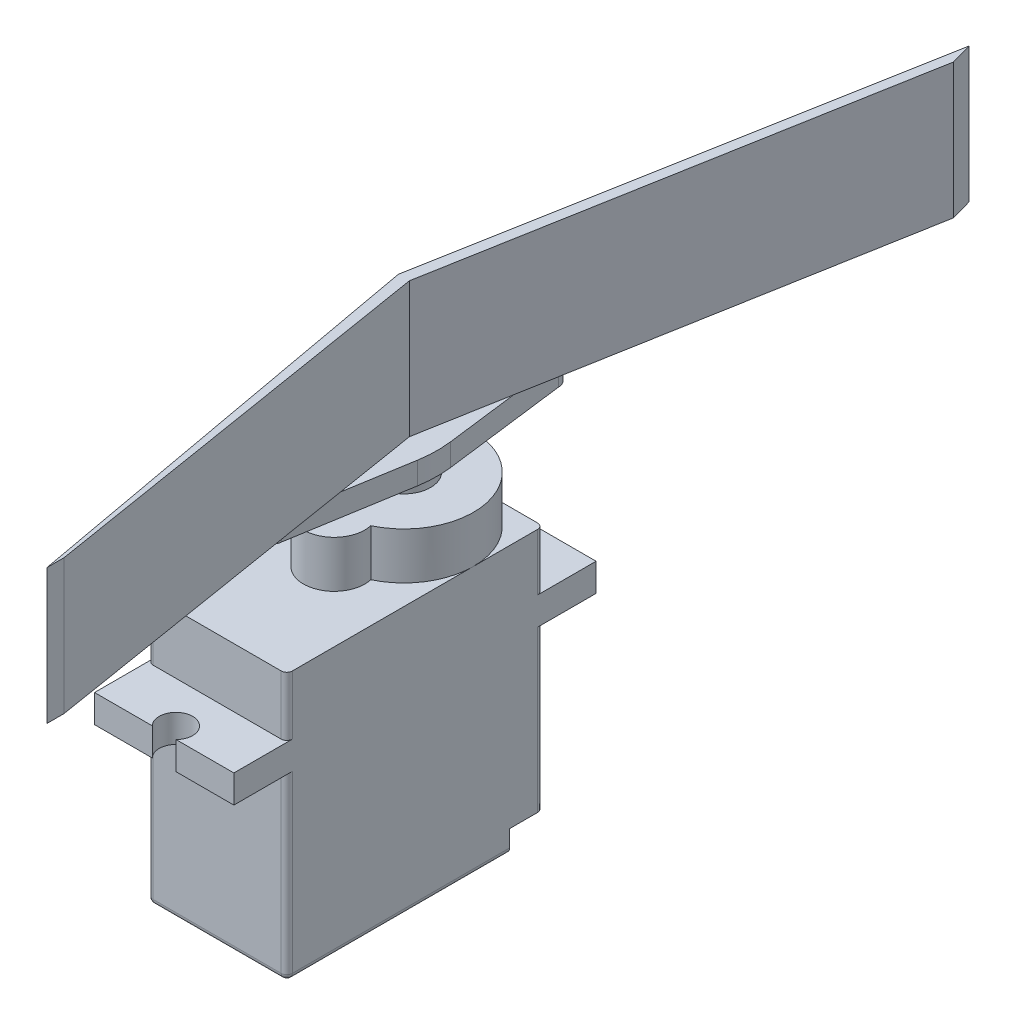
from build123d import *

# Parameters (mm, degrees)
SKETCH1_W               = 12.5
SKETCH1_H               = 23
BOSS_EXTRUDE1_DEPTH     = 24
BOSS_EXTRUDE2_DEPTH     = 4.2
SKETCH3_R               = 2.4
SKETCH3_R_2             = 0.5
BOSS_EXTRUDE3_DEPTH     = 3
SKETCH4_W               = 12.5
SKETCH4_H               = 2.5
BOSS_EXTRUDE4_DEPTH     = 4.75
SKETCH5_W               = 12.5
SKETCH5_H               = 2.5
BOSS_EXTRUDE5_DEPTH     = 4.75
CUT_EXTRUDE1_REACH      = 27.55
SKETCH6_R               = 1.5
CUT_EXTRUDE2_REACH      = 27.697
SKETCH8_R               = 1.5
CUT_EXTRUDE4_DEPTH      = 38.33299479
CUT_EXTRUDE6_DEPTH      = 38.33299479
CUT_EXTRUDE6_DEPTH_BACK = 2.3
CUT_EXTRUDE7_DEPTH      = 38.33299479
CUT_EXTRUDE7_DEPTH_BACK = 2.3
FILLET1_R               = 0.5
SALIENTE_EXTRUIR2_START = -2
CROQUIS2_R              = 2.4
SALIENTE_EXTRUIR2_DEPTH = 2
REDONDEO1_R             = 10
SALIENTE_EXTRUIR5_DEPTH = 12.116642018


with BuildPart() as part:
    # Sketch1 → Boss-Extrude1 (new body)
    with BuildSketch(Plane(origin=(0, 0, 0), x_dir=(1, 0, 0), z_dir=(0, 1, 0))):
        Rectangle(SKETCH1_W, SKETCH1_H)
    extrude(amount=BOSS_EXTRUDE1_DEPTH)

    # Sketch2 → Boss-Extrude2 (add)
    with BuildSketch(Plane(origin=(0, 24, 0), x_dir=(1, 0, 0), z_dir=(0, 1, 0))):
        with BuildLine():
            ThreePointArc((2.682624648, -0.395), (0, 11.5), (-2.682624648, -0.395))
            ThreePointArc((-2.682624648, -0.395), (0, -3.75), (2.682624648, -0.395))
        make_face()
    extrude(amount=BOSS_EXTRUDE2_DEPTH)

    # Sketch3 → Boss-Extrude3 (add)
    with BuildSketch(Plane(origin=(0, 28.2, 0), x_dir=(1, 0, 0), z_dir=(0, 1, 0))):
        with Locations(Location((0, 5.25, 0), (0, 0, 270))):
            Circle(SKETCH3_R)
        with Locations(Location((0, 5.25, 0), (0, 0, 270))):
            Circle(SKETCH3_R_2, mode=Mode.SUBTRACT)
    extrude(amount=BOSS_EXTRUDE3_DEPTH)

    # Sketch4 → Boss-Extrude4 (add)
    with BuildSketch(Plane(origin=(0, 0, -11.5), x_dir=(-1, 0, 0), z_dir=(0, 0, -1))):
        with Locations((0, 17.65)):
            Rectangle(SKETCH4_W, SKETCH4_H)
    extrude(amount=BOSS_EXTRUDE4_DEPTH)

    # Sketch5 → Boss-Extrude5 (add)
    with BuildSketch(Plane.XY.offset(11.5)):
        with Locations((0, 17.45)):
            Rectangle(SKETCH5_W, SKETCH5_H)
    extrude(amount=BOSS_EXTRUDE5_DEPTH)

    # Sketch6 → Cut-Extrude1 (cut, up to next)
    with BuildSketch(Plane(origin=(0, 18.7, 0), x_dir=(1, 0, 0), z_dir=(0, 1, 0)), mode=Mode.PRIVATE) as cut_extrude1_sk1:
        with Locations((0, -15.2)):
            Circle(SKETCH6_R)
    cut_extrude1_tool1 = extrude(cut_extrude1_sk1.sketch, amount=-CUT_EXTRUDE1_REACH, mode=Mode.PRIVATE) & part.part
    add(cut_extrude1_tool1.solids().sort_by_distance((0, 18.7, 15.2))[0], mode=Mode.SUBTRACT)

    # Sketch8 → Cut-Extrude2 (cut, up to next)
    with BuildSketch(Plane(origin=(0, 18.9, 0), x_dir=(1, 0, 0), z_dir=(0, 1, 0)), mode=Mode.PRIVATE) as cut_extrude2_sk1:
        with Locations((0, 15.2)):
            Circle(SKETCH8_R)
    cut_extrude2_tool1 = extrude(cut_extrude2_sk1.sketch, amount=-CUT_EXTRUDE2_REACH, mode=Mode.PRIVATE) & part.part
    add(cut_extrude2_tool1.solids().sort_by_distance((0, 18.9, -15.2))[0], mode=Mode.SUBTRACT)

    # Sketch9 → Cut-Extrude4 (cut, through all)
    with BuildSketch(Plane(origin=(6.25, 0, 0), x_dir=(0, 0, -1), z_dir=(1, 0, 0))):
        Polygon((11.5, 2), (8.5, 0), (11.5, 0), align=None)
    extrude(amount=-CUT_EXTRUDE4_DEPTH, mode=Mode.SUBTRACT)

    # Sketch10 → Cut-Extrude6 (cut, two sides: drawn at the far end of the back side and taken through both)
    with BuildSketch(Plane(origin=(6.25, 0, 0), x_dir=(0, 0, -1), z_dir=(1, 0, 0)).offset(-CUT_EXTRUDE6_DEPTH_BACK)):
        Polygon((102.065563363, 2), (11.5, 2), (8.5, 2), (8.5, 0), (8.5, -90.565563363), (135.889097577, -219.33086493), (229.45466094, -126.765301567), align=None)
    extrude(amount=CUT_EXTRUDE6_DEPTH + CUT_EXTRUDE6_DEPTH_BACK, mode=Mode.SUBTRACT)

    # Sketch11 → Cut-Extrude7 (cut, two sides: drawn at the far end of the back side and taken through both)
    with BuildSketch(Plane.ZY.offset(6.25).offset(-CUT_EXTRUDE7_DEPTH_BACK)):
        Polygon((-102.065563363, 2), (-11.5, 2), (-8.5, 2), (-8.5, 0), (-8.5, -90.565563363), (-135.889097577, -219.33086493), (-229.45466094, -126.765301567), align=None)
    extrude(amount=CUT_EXTRUDE7_DEPTH + CUT_EXTRUDE7_DEPTH_BACK, mode=Mode.SUBTRACT)

    # Fillet1
    fillet1_edges = [part.edges().sort_by_distance(p)[0] for p in [
        (-6.25, 9.2, -11.5),
        (6.25, 9.2, -11.5),
        (6.25, 8.1, 11.5),
        (-6.25, 8.1, 11.5),
        (6.25, 0, 1.5),
        (0, 0, 11.5),
        (-6.25, 21.45, -11.5),
        (6.25, 21.45, -11.5),
        (6.25, 21.35, 11.5),
        (-6.25, 0, 1.5),
        (-6.25, 21.35, 11.5),
    ]]
    fillet(fillet1_edges, radius=FILLET1_R)

    # Croquis2 → Saliente-Extruir2 (add)
    with BuildSketch(Plane(origin=(0, 31.2, 0), x_dir=(1, 0, 0), z_dir=(0, 1, 0)).offset(SALIENTE_EXTRUIR2_START)):
        with BuildLine():
            Line((-2.926200175, 5.25), (-0.834835747, -6.772385738))
            ThreePointArc((-0.834835747, -6.772385738), (0.100143784, -7.508414302), (0.947766476, -6.673273269))
            Line((0.947766476, -6.673273269), (2.926200175, 5.25))
            Line((2.926200175, 5.25), (1.339323404, 17.768743365))
            ThreePointArc((1.339323404, 17.768743365), (0.226116887, 18.849246596), (-0.854386344, 17.736040078))
            Line((-0.854386344, 17.736040078), (-2.926200175, 5.25))
        make_face()
        with Locations((0, 5.25)):
            Circle(CROQUIS2_R, mode=Mode.SUBTRACT)
    extrude(amount=SALIENTE_EXTRUIR2_DEPTH)

    # Redondeo1
    redondeo1_edges = [part.edges().sort_by_distance(p)[0] for p in [
        (-2.926200175, 30.2, -5.25),
        (2.926200175, 30.2, -5.25),
    ]]
    fillet(redondeo1_edges, radius=REDONDEO1_R)


with BuildPart() as body_2:
    # Croquis3 → Saliente-Extruir5 (new body)
    with BuildSketch(Plane(origin=(0, 31.2, 0), x_dir=(1, 0, 0), z_dir=(0, 1, 0))):
        Polygon((-0.5, 5.25), (7.362800966, 48.599539288), (7.90454263, 46.649269295), (0.5, 5.25), (6.521630696, -31.753310854), (6.521630696, -33.289699738), align=None)
    extrude(amount=SALIENTE_EXTRUIR5_DEPTH)


solid = Compound([part.part, body_2.part])
